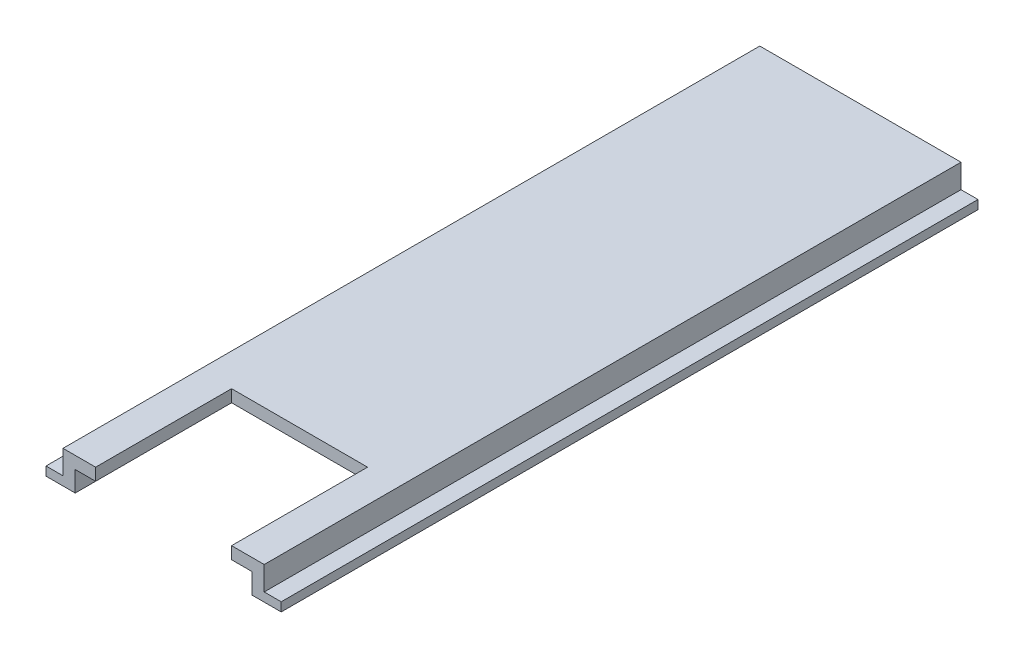
from build123d import *

# Parameters (mm, degrees)
EXTRUDE_1_DEPTH     = 56.5
CUT_EXTRUDE_1_REACH = 61.662
SKETCH_2_W          = 20
SKETCH_2_H          = 20
CUT_EXTRUDE_2_DEPTH = 60.661545404
EXTRUDE_2_DEPTH     = 46


with BuildPart() as part:
    # 草图1 → 凸台-拉伸1 (new body)
    with BuildSketch(Plane.XY):
        Polygon((-16.5, 0), (-16.5, 1.5), (-14, 1.5), (-14, 5), (16, 5), (16, 1.5), (18.5, 1.5), (18.5, 0), (14, 0), (14, 3), (-12, 3), (-12, 0), align=None)
    extrude(amount=EXTRUDE_1_DEPTH)

    # 草图2 → 切除-拉伸1 (cut, up to next)
    with BuildSketch(Plane(origin=(0, 5, 0), x_dir=(1, 0, 0), z_dir=(0, 1, 0)), mode=Mode.PRIVATE) as cut_extrude_1_sk1:
        with Locations((1, -46.5)):
            Rectangle(SKETCH_2_W, SKETCH_2_H)
    cut_extrude_1_tool1 = extrude(cut_extrude_1_sk1.sketch, amount=-CUT_EXTRUDE_1_REACH, mode=Mode.PRIVATE) & part.part
    add(cut_extrude_1_tool1.solids().sort_by_distance((1, 5, 46.5))[0], mode=Mode.SUBTRACT)

    # 草图3 → 切除-拉伸2 (cut, through all)
    with BuildSketch(Plane.XY.offset(56.5)):
        Polygon((-16.3, 0), (-16.3, 1.3), (-13.8, 1.3), (-13.8, 4.8), (15.8, 4.8), (15.8, 1.3), (18.3, 1.3), (18.3, 0), (18.5, 0), (18.5, 1.5), (16, 1.5), (16, 5), (-14, 5), (-14, 1.5), (-16.5, 1.5), (-16.5, 0), align=None)
    extrude(amount=-CUT_EXTRUDE_2_DEPTH, mode=Mode.SUBTRACT)

    # 草图4 → 凸台-拉伸2 (add)
    with BuildSketch(Plane(origin=(0, 0, 0), x_dir=(-1, 0, 0), z_dir=(0, 0, -1))):
        Polygon((-15.8, 1.3), (-18.3, 1.3), (-18.3, 0), (-14, 0), (-14, 3), (12, 3), (12, 0), (16.3, 0), (16.3, 1.3), (13.8, 1.3), (13.8, 4.8), (-15.8, 4.8), align=None)
    extrude(amount=EXTRUDE_2_DEPTH)


solid = part.part
